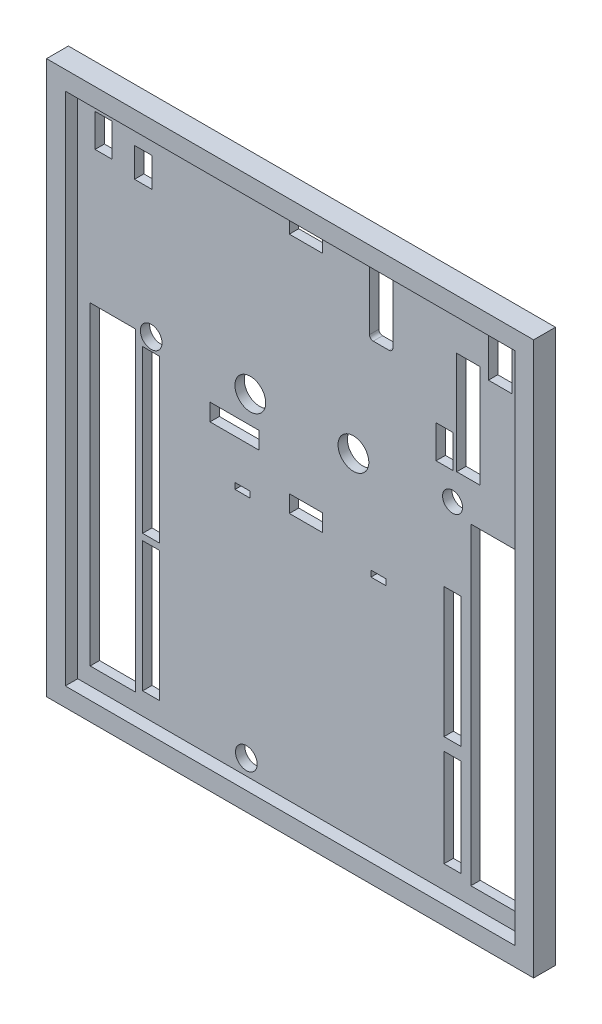
from build123d import *

# Parameters (mm, degrees)
SKETCH1_W           = 78
SKETCH1_H           = 88.5
SKETCH1_W_2         = 72
SKETCH1_H_2         = 82.5
BOSS_EXTRUDE1_DEPTH = 2
SKETCH2_W           = 78
SKETCH2_H           = 88.5
BOSS_EXTRUDE2_DEPTH = 1.5
SKETCH7_W           = 7.279998142
SKETCH7_H           = 50.36
SKETCH7_W_2         = 7.079999996
SKETCH7_H_2         = 50.160000192
CUT_EXTRUDE1_DEPTH  = 15
SKETCH8_R           = 1.738
SKETCH8_R_2         = 1.6
CUT_EXTRUDE2_DEPTH  = 10
SKETCH9_R           = 2.464925529
CUT_EXTRUDE3_DEPTH  = 10
SKETCH11_W          = 5.279999902
SKETCH11_H          = 2.74
SKETCH11_W_2        = 2.74
SKETCH11_H_2        = 5.28
SKETCH11_W_3        = 7.819999902
SKETCH11_W_4        = 5.280000098
SKETCH11_H_3        = 2.739999805
CUT_EXTRUDE4_DEPTH  = 10
SKETCH10_W          = 2.740000978
SKETCH10_H          = 25.907999907
SKETCH10_W_2        = 2.739999218
SKETCH10_H_2        = 20.828000093
SKETCH10_W_3        = 2.73999941
SKETCH10_H_3        = 15.594000099
SKETCH10_W_4        = 3.739999409
SKETCH10_H_4        = 16.440000004
SKETCH10_W_5        = 2.739999409
SKETCH10_H_5        = 15.440000004
SKETCH10_W_6        = 3.739999801
SKETCH10_H_6        = 6.280000102
SKETCH10_W_7        = 2.739999801
SKETCH10_H_7        = 5.280000102
CUT_EXTRUDE5_DEPTH  = 10
CUT_EXTRUDE6_DEPTH  = 10


with BuildPart() as part:
    # Sketch1 → Boss-Extrude1 (new body)
    with BuildSketch(Plane.XY):
        with Locations((19.784172662, -18.690647482)):
            Rectangle(SKETCH1_W, SKETCH1_H)
        with Locations((19.784172662, -18.690647482)):
            Rectangle(SKETCH1_W_2, SKETCH1_H_2, mode=Mode.SUBTRACT)
    extrude(amount=BOSS_EXTRUDE1_DEPTH)

    # Sketch2 → Boss-Extrude2 (add)
    with BuildSketch(Plane(origin=(0, 0, 0), x_dir=(-1, 0, 0), z_dir=(0, 0, -1))):
        with Locations((-19.784172662, -18.690647482)):
            Rectangle(SKETCH2_W, SKETCH2_H)
    extrude(amount=BOSS_EXTRUDE2_DEPTH)

    # Sketch7 → Cut-Extrude1 (cut)
    with BuildSketch(Plane.XY):
        with Locations((-10.583804942, -31.990645157)):
            Rectangle(SKETCH7_W, SKETCH7_H)
        with Locations((50.276195985, -32.090647407)):
            Rectangle(SKETCH7_W_2, SKETCH7_H_2)
    extrude(amount=-CUT_EXTRUDE1_DEPTH, mode=Mode.SUBTRACT)

    # Sketch8 → Cut-Extrude2 (cut)
    with BuildSketch(Plane(origin=(0, 0, -1.5), x_dir=(-1, 0, 0), z_dir=(0, 0, -1))):
        with Locations((-10.782151243, -57.440646574)):
            Circle(SKETCH8_R)
        with Locations((4.457850712, -6.640647161)):
            Circle(SKETCH8_R)
        with Locations((-43.802149239, -5.370645303)):
            Circle(SKETCH8_R_2)
    extrude(amount=-CUT_EXTRUDE2_DEPTH, mode=Mode.SUBTRACT)

    # Sketch9 → Cut-Extrude3 (cut)
    with BuildSketch(Plane(origin=(0, 0, -1.5), x_dir=(-1, 0, 0), z_dir=(0, 0, -1))):
        with Locations((-27.927151828, -6.640645914)):
            Circle(SKETCH9_R)
        with Locations((-11.417149288, -6.64064655)):
            Circle(SKETCH9_R)
    extrude(amount=-CUT_EXTRUDE3_DEPTH, mode=Mode.SUBTRACT)

    # Sketch11 → Cut-Extrude4 (cut)
    with BuildSketch(Plane(origin=(0, 0, -1.5), x_dir=(-1, 0, 0), z_dir=(0, 0, -1))):
        with Locations((-20.306157662, 20.028363095)):
            Rectangle(SKETCH11_W, SKETCH11_H)
        with Locations((-42.531158468, 1.615345297)):
            Rectangle(SKETCH11_W_2, SKETCH11_H_2)
        with Locations((-8.877149508, -12.355646794)):
            Rectangle(SKETCH11_W_3, SKETCH11_H)
        with Locations((-20.308140255, -18.704655608)):
            Rectangle(SKETCH11_W_4, SKETCH11_H_3)
        with Locations((12.078842143, 17.490343195)):
            Rectangle(SKETCH11_W_2, SKETCH11_H_2)
    extrude(amount=-CUT_EXTRUDE4_DEPTH, mode=Mode.SUBTRACT)

    # Sketch10 → Cut-Extrude5 (cut)
    # profile 1 of 10: a face of its own
    with BuildSketch(Plane(origin=(0, 0, -1.5), x_dir=(-1, 0, 0), z_dir=(0, 0, -1))):
        with Locations((4.457850135, -21.62664716)):
            Rectangle(SKETCH10_W, SKETCH10_H)
    # profile 2 of 10: a face of its own
    with BuildSketch(Plane(origin=(0, 0, -1.5), x_dir=(-1, 0, 0), z_dir=(0, 0, -1))):
        with Locations((4.457849197, -46.01064716)):
            Rectangle(SKETCH10_W_2, SKETCH10_H_2)
    # profile 3 of 10: a face of its own
    with BuildSketch(Plane(origin=(0, 0, -1.5), x_dir=(-1, 0, 0), z_dir=(0, 0, -1))):
        with Locations((-43.802150903, -48.473645307)):
            Rectangle(SKETCH10_W_3, SKETCH10_H_3)
    # profile 4 of 10: a face of its own
    with BuildSketch(Plane(origin=(0, 0, -1.5), x_dir=(-1, 0, 0), z_dir=(0, 0, -1))):
        with Locations((-43.802150119, -28.230645304)):
            Rectangle(SKETCH10_W_2, SKETCH10_H_2)
    # profile 5 of 10: a face of its own
    with BuildSketch(Plane(origin=(0, 0, -1.5), x_dir=(-1, 0, 0), z_dir=(0, 0, -1))):
        with Locations((-46.342148749, 7.329354744)):
            Rectangle(SKETCH10_W_4, SKETCH10_H_4)
        with Locations((-46.342148749, 7.329354744)):
            Rectangle(SKETCH10_W_5, SKETCH10_H_5, mode=Mode.SUBTRACT)
    # profile 6 of 10: a face of its own
    with BuildSketch(Plane(origin=(0, 0, -1.5), x_dir=(-1, 0, 0), z_dir=(0, 0, -1))):
        with Locations((-46.342148749, 7.329354744)):
            Rectangle(SKETCH10_W_5, SKETCH10_H_5)
    # profile 7 of 10: a face of its own
    with BuildSketch(Plane(origin=(0, 0, -1.5), x_dir=(-1, 0, 0), z_dir=(0, 0, -1))):
        with Locations((-51.421157761, 17.490345588)):
            Rectangle(SKETCH10_W_6, SKETCH10_H_6)
        with Locations((-51.421157761, 17.490345588)):
            Rectangle(SKETCH10_W_7, SKETCH10_H_7, mode=Mode.SUBTRACT)
    # profile 8 of 10: a face of its own
    with BuildSketch(Plane(origin=(0, 0, -1.5), x_dir=(-1, 0, 0), z_dir=(0, 0, -1))):
        with Locations((-51.421157761, 17.490345588)):
            Rectangle(SKETCH10_W_7, SKETCH10_H_7)
    # profile 9 of 10: a face of its own
    with BuildSketch(Plane(origin=(0, 0, -1.5), x_dir=(-1, 0, 0), z_dir=(0, 0, -1))):
        with BuildLine():
            Line((-31.10214819, 21.899354208), (-33.64214819, 21.899354306))
            ThreePointArc((-33.64214819, 21.899354306), (-34.066412265, 21.723618391), (-34.242148213, 21.299354329))
            Line((-34.242148213, 21.299354329), (-34.242148604, 11.139354329))
            ThreePointArc((-34.242148604, 11.139354329), (-34.066412689, 10.715090253), (-33.642148627, 10.539354306))
            Line((-33.642148627, 10.539354306), (-31.102148627, 10.539354208))
            ThreePointArc((-31.102148627, 10.539354208), (-30.677884552, 10.715090123), (-30.502148604, 11.139354185))
            Line((-30.502148604, 11.139354185), (-30.502148213, 21.299354185))
            ThreePointArc((-30.502148213, 21.299354185), (-30.677884128, 21.72361826), (-31.10214819, 21.899354208))
        make_face()
        with BuildLine():
            ThreePointArc((-33.742148604, 11.139354309), (-33.712859285, 11.06864363), (-33.642148608, 11.039354306))
            Line((-33.642148608, 11.039354306), (-31.102148608, 11.039354208))
            ThreePointArc((-31.102148608, 11.039354208), (-31.031437929, 11.068643527), (-31.002148604, 11.139354204))
            Line((-31.002148604, 11.139354204), (-31.002148213, 21.299354204))
            ThreePointArc((-31.002148213, 21.299354204), (-31.031437532, 21.370064883), (-31.102148209, 21.399354208))
            Line((-31.102148209, 21.399354208), (-33.642148209, 21.399354306))
            ThreePointArc((-33.642148209, 21.399354306), (-33.712858888, 21.370064986), (-33.742148213, 21.299354309))
            Line((-33.742148213, 21.299354309), (-33.742148604, 11.139354309))
        make_face(mode=Mode.SUBTRACT)
    # profile 10 of 10: a face of its own
    with BuildSketch(Plane(origin=(0, 0, -1.5), x_dir=(-1, 0, 0), z_dir=(0, 0, -1))):
        with BuildLine():
            Line((-33.742148213, 21.299354309), (-33.742148604, 11.139354309))
            ThreePointArc((-33.742148604, 11.139354309), (-33.712859285, 11.06864363), (-33.642148608, 11.039354306))
            Line((-33.642148608, 11.039354306), (-31.102148608, 11.039354208))
            ThreePointArc((-31.102148608, 11.039354208), (-31.031437929, 11.068643527), (-31.002148604, 11.139354204))
            Line((-31.002148604, 11.139354204), (-31.002148213, 21.299354204))
            ThreePointArc((-31.002148213, 21.299354204), (-31.031437532, 21.370064883), (-31.102148209, 21.399354208))
            Line((-31.102148209, 21.399354208), (-33.642148209, 21.399354306))
            ThreePointArc((-33.642148209, 21.399354306), (-33.712858888, 21.370064986), (-33.742148213, 21.299354309))
        make_face()
    extrude(amount=-CUT_EXTRUDE5_DEPTH, mode=Mode.SUBTRACT)

    # Sketch12 → Cut-Extrude6 (cut)
    with BuildSketch(Plane(origin=(0, 0, -1.5), x_dir=(-1, 0, 0), z_dir=(0, 0, -1))):
        Polygon((-33.108749893, -22.363499715), (-32.143549893, -22.363499752), (-30.746549856, -22.363499715), (-30.746549856, -21.398299806), (-31.711749856, -21.398299769), (-33.108749893, -21.398299806), align=None)
        Polygon((-11.328249844, -20.128046644), (-11.328249844, -21.093246553), (-10.363049844, -21.09324659), (-8.966049807, -21.093246553), (-8.966049807, -20.128046644), (-9.931249807, -20.128046607), align=None)
        Polygon((4.326251742, 13.867754697), (5.826253641, 13.867754697), (7.129451441, 13.867754697), (7.129451441, 18.570950884), (5.629449542, 18.570950884), (4.326251742, 18.570950884), align=None)
    extrude(amount=-CUT_EXTRUDE6_DEPTH, mode=Mode.SUBTRACT)


solid = part.part
